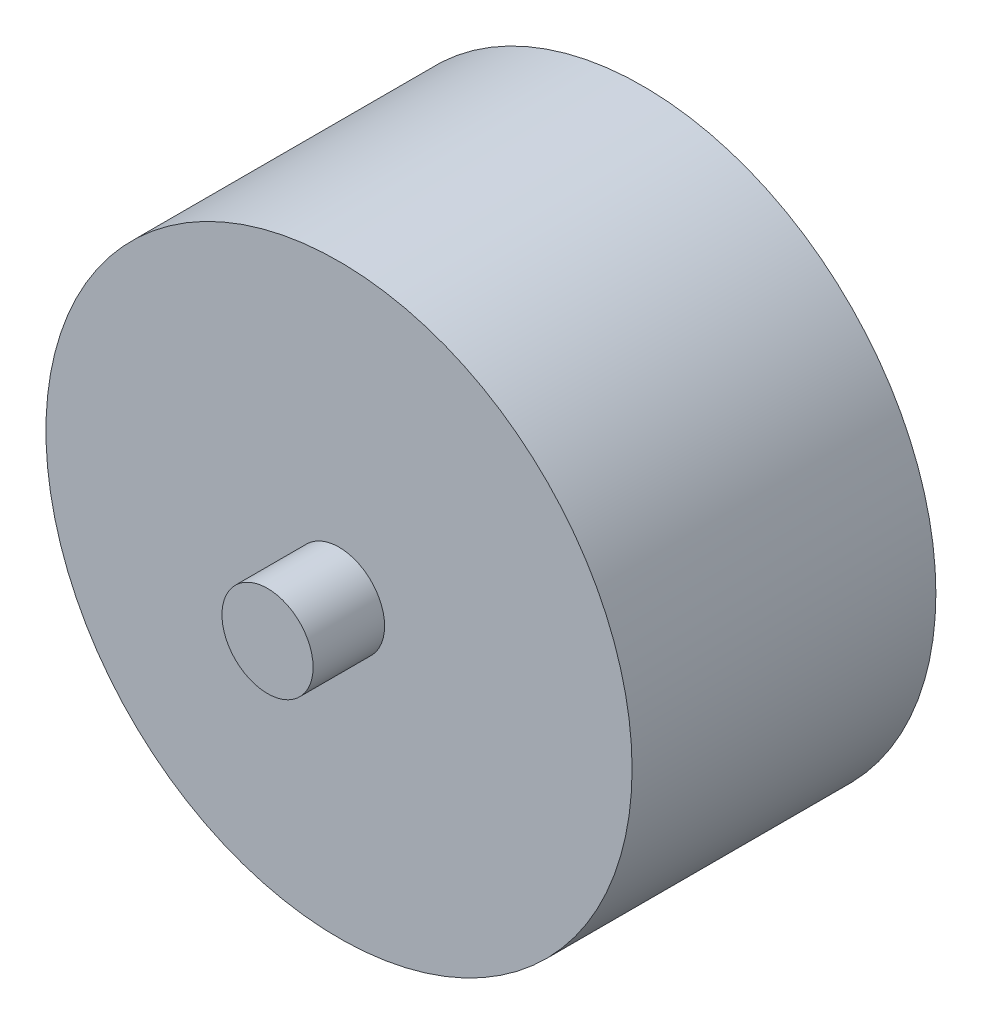
from build123d import *

# Parameters (mm, degrees)
SKETCH_1_R          = 16.4
EXTRUDE_1_DEPTH     = 17
SKETCH_2_R          = 2.55
EXTRUDE_2_DEPTH     = 4
SKETCH_3_R          = 10.075
EXTRUDE_3_DEPTH     = 2
SKETCH_7_R          = 1.05
CUT_EXTRUDE_3_DEPTH = 10


with BuildPart() as part:
    # 草图1 → 凸台-拉伸1 (new body)
    with BuildSketch(Plane.XY):
        Circle(SKETCH_1_R)
    extrude(amount=EXTRUDE_1_DEPTH)

    # 草图2 → 凸台-拉伸2 (add)
    with BuildSketch(Plane.XY.offset(17)):
        Circle(SKETCH_2_R)
    extrude(amount=EXTRUDE_2_DEPTH)


with BuildPart() as body_2:
    # 草图3 → 凸台-拉伸3 (new body)
    with BuildSketch(Plane(origin=(0, 0, 0), x_dir=(-1, 0, 0), z_dir=(0, 0, -1))):
        Circle(SKETCH_3_R)
    extrude(amount=EXTRUDE_3_DEPTH)


with BuildPart() as cut_extrude_3_tool:
    # 草图7 → 切除-拉伸3 (new body)
    with BuildSketch(Plane(origin=(0, 0, -2), x_dir=(-1, 0, 0), z_dir=(0, 0, -1))):
        with Locations((0, 8)):
            Circle(SKETCH_7_R)
        with Locations((8, 0)):
            Circle(SKETCH_7_R)
        with Locations((0, -8)):
            Circle(SKETCH_7_R)
        with Locations((-8, 0)):
            Circle(SKETCH_7_R)
    extrude(amount=-CUT_EXTRUDE_3_DEPTH)


with BuildPart() as part_1:
    add(part.part)

    # 切除-拉伸3: cut by cut_extrude_3_tool
    add(cut_extrude_3_tool.part, mode=Mode.SUBTRACT)


with BuildPart() as body_2_1:
    add(body_2.part)

    # 切除-拉伸3: cut by cut_extrude_3_tool
    add(cut_extrude_3_tool.part, mode=Mode.SUBTRACT)


solid = Compound([part_1.part, body_2_1.part])
